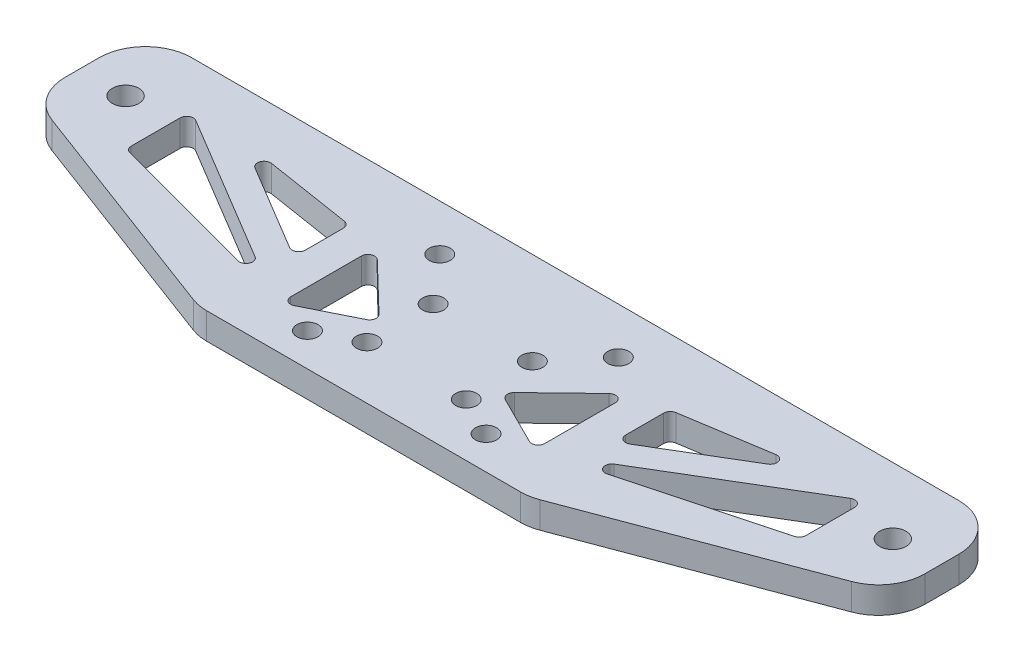
from build123d import *

# Parameters (mm, degrees)
EXTRUDE_1_DEPTH     = 4
SKETCH_2_R          = 1.6
CUT_EXTRUDE_1_DEPTH = 72.700767081
SKETCH_3_R          = 2
SKETCH_3_R_2        = 1.6
CUT_EXTRUDE_2_DEPTH = 72.700767081
SKETCH_4_W          = 130
SKETCH_4_H          = 2
EXTRUDE_2_DEPTH     = 4
FILLET_1_R          = 7


with BuildPart() as part:
    # 草图1 → 凸台-拉伸1 (new body)
    with BuildSketch(Plane(origin=(0, 0, 0), x_dir=(1, 0, 0), z_dir=(0, 1, 0))):
        Polygon((25, 0), (-25, 0), (-65, 15), (-65, 30), (65, 30), (65, 15), align=None)
    extrude(amount=EXTRUDE_1_DEPTH)

    # 草图2 → 切除-拉伸1 (cut, through all)
    with BuildSketch(Plane(origin=(0, 4, 0), x_dir=(1, 0, 0), z_dir=(0, 1, 0))):
        with Locations(Location((-7.5, 18, 0), (0, 0, 270))):
            Circle(SKETCH_2_R)
        with Locations(Location((7.5, 18, 0), (0, 0, 90))):
            Circle(SKETCH_2_R)
        with Locations(Location((-7.5, 8, 0), (0, 0, 90))):
            Circle(SKETCH_2_R)
        with Locations(Location((7.5, 8, 0), (0, 0, 270))):
            Circle(SKETCH_2_R)
    extrude(amount=-CUT_EXTRUDE_1_DEPTH, mode=Mode.SUBTRACT)

    # 草图3 → 切除-拉伸2 (cut, through all)
    with BuildSketch(Plane(origin=(0, 4, 0), x_dir=(1, 0, 0), z_dir=(0, 1, 0))):
        with Locations(Location((-58, 22, 0), (0, 0, 270))):
            Circle(SKETCH_3_R)
        with Locations(Location((58, 22, 0), (0, 0, 90))):
            Circle(SKETCH_3_R)
        with Locations(Location((-13.5, 5, 0), (0, 0, 270))):
            Circle(SKETCH_3_R_2)
        with Locations(Location((-13.5, 25, 0), (0, 0, 270))):
            Circle(SKETCH_3_R_2)
        with Locations(Location((13.5, 5, 0), (0, 0, 90))):
            Circle(SKETCH_3_R_2)
        with Locations(Location((13.5, 25, 0), (0, 0, 90))):
            Circle(SKETCH_3_R_2)
        with BuildLine():
            Line((-51, 23.236030392), (-51, 15.857143498))
            ThreePointArc((-51, 15.857143498), (-50.793424544, 15.248474875), (-50.259045015, 14.891278248))
            Line((-50.259045015, 14.891278248), (-27.921339757, 8.900306744))
            ThreePointArc((-27.921339757, 8.900306744), (-26.741501421, 9.476121152), (-27.148724711, 10.724219675))
            Line((-27.148724711, 10.724219675), (-49.486429968, 24.094078073))
            ThreePointArc((-49.486429968, 24.094078073), (-50.493168312, 24.105964306), (-51, 23.236030392))
        make_face()
        with BuildLine():
            Line((-38.782523044, 22.349179917), (-25.724953573, 14.533790966))
            ThreePointArc((-25.724953573, 14.533790966), (-24.718215229, 14.521904732), (-24.211383541, 15.391838647))
            Line((-24.211383541, 15.391838647), (-24.211383541, 21.145506102))
            ThreePointArc((-24.211383541, 21.145506102), (-24.451132736, 21.795135776), (-25.055420968, 22.133269067))
            Line((-25.055420968, 22.133269067), (-38.112990439, 24.194990563))
            ThreePointArc((-38.112990439, 24.194990563), (-39.209019504, 23.548218787), (-38.782523044, 22.349179917))
        make_face()
        with BuildLine():
            Line((-10.229137867, 12.546046067), (-17.517122215, 19.57620297))
            ThreePointArc((-17.517122215, 19.57620297), (-18.602368626, 19.776876975), (-19.211383541, 18.856479961))
            Line((-19.211383541, 18.856479961), (-19.211383541, 8.182330884))
            ThreePointArc((-19.211383541, 8.182330884), (-18.737114654, 7.331680075), (-17.764169946, 7.287903693))
            Line((-17.764169946, 7.287903693), (-10.476185598, 10.931895866))
            ThreePointArc((-10.476185598, 10.931895866), (-9.934909706, 11.67503349), (-10.229137867, 12.546046067))
        make_face()
        with BuildLine():
            Line((17.764169946, 7.287903693), (10.476185598, 10.931895866))
            ThreePointArc((10.476185598, 10.931895866), (9.934909706, 11.67503349), (10.229137867, 12.546046067))
            Line((10.229137867, 12.546046067), (17.517122215, 19.57620297))
            ThreePointArc((17.517122215, 19.57620297), (18.602368626, 19.776876975), (19.211383541, 18.856479961))
            Line((19.211383541, 18.856479961), (19.211383541, 8.182330884))
            ThreePointArc((19.211383541, 8.182330884), (18.737114654, 7.331680075), (17.764169946, 7.287903693))
        make_face()
        with BuildLine():
            Line((25.055420968, 22.133269067), (38.112990439, 24.194990563))
            ThreePointArc((38.112990439, 24.194990563), (39.209019504, 23.548218787), (38.782523044, 22.349179917))
            Line((38.782523044, 22.349179917), (25.724953573, 14.533790966))
            ThreePointArc((25.724953573, 14.533790966), (24.718215229, 14.521904732), (24.211383541, 15.391838647))
            Line((24.211383541, 15.391838647), (24.211383541, 21.145506102))
            ThreePointArc((24.211383541, 21.145506102), (24.451132736, 21.795135776), (25.055420968, 22.133269067))
        make_face()
        with BuildLine():
            Line((27.148724711, 10.724219675), (49.486429968, 24.094078073))
            ThreePointArc((49.486429968, 24.094078073), (50.493168312, 24.105964306), (51, 23.236030392))
            Line((51, 23.236030392), (51, 15.857143498))
            ThreePointArc((51, 15.857143498), (50.793424544, 15.248474875), (50.259045015, 14.891278248))
            Line((50.259045015, 14.891278248), (27.921339757, 8.900306744))
            ThreePointArc((27.921339757, 8.900306744), (26.741501421, 9.476121152), (27.148724711, 10.724219675))
        make_face()
    extrude(amount=-CUT_EXTRUDE_2_DEPTH, mode=Mode.SUBTRACT)

    # 草图4 → 凸台-拉伸2 (add)
    with BuildSketch(Plane(origin=(0, 4, 0), x_dir=(1, 0, 0), z_dir=(0, 1, 0))):
        with Locations((0, 31)):
            Rectangle(SKETCH_4_W, SKETCH_4_H)
    extrude(amount=-EXTRUDE_2_DEPTH)

    # 圆角1
    fillet_1_edges = [part.edges().sort_by_distance(p)[0] for p in [
        (-65, 2, -15),
        (65, 2, -15),
        (25, 2, 0),
        (-25, 2, 0),
        (-65, 2, -32),
        (65, 2, -32),
    ]]
    fillet(fillet_1_edges, radius=FILLET_1_R)


solid = part.part
